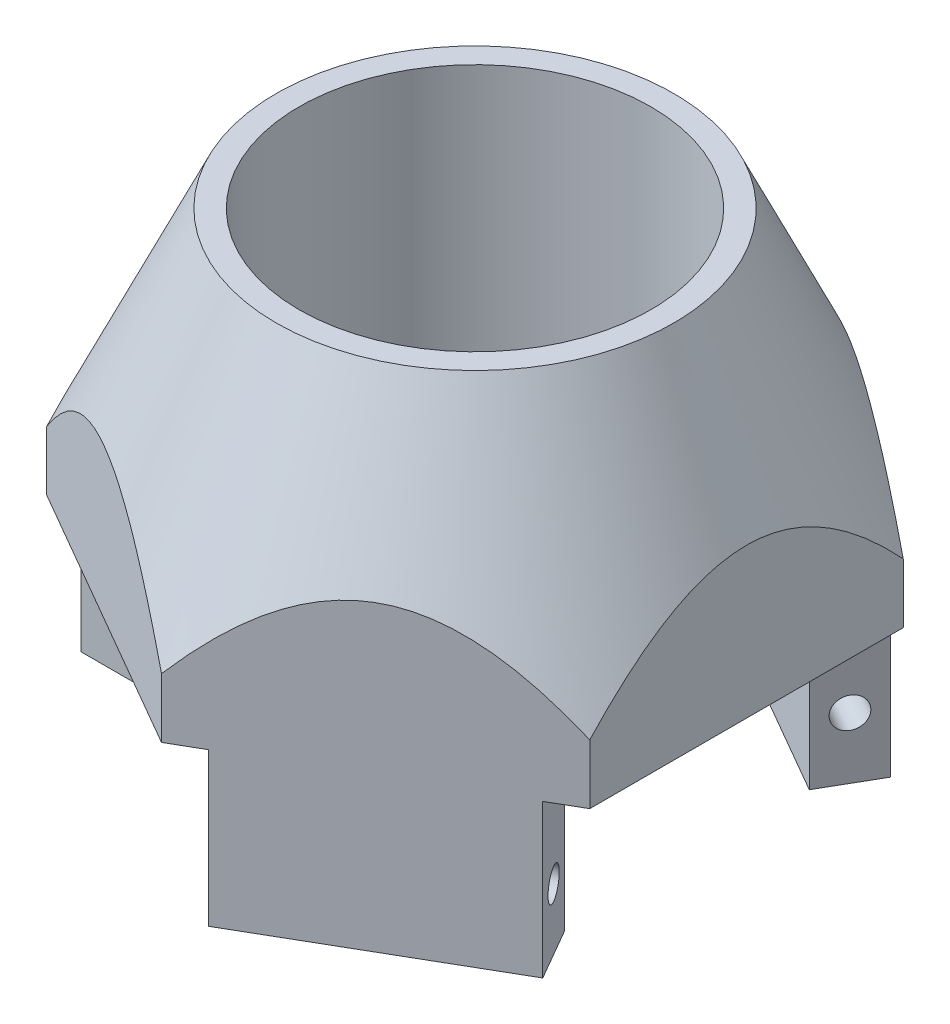
from build123d import *

# Parameters (mm, degrees)
SKETCH1_R           = 11.5
BOSS_EXTRUDE1_DEPTH = 30
SKETCH4_R           = 11.5
CUT_EXTRUDE1_DEPTH  = 10
SKETCH5_R           = 1
CUT_EXTRUDE2_DEPTH  = 46.027075188
SKETCH6_R           = 1
CUT_EXTRUDE3_DEPTH  = 46.928613086
SKETCH7_R           = 1
CUT_EXTRUDE4_DEPTH  = 46.928613086


with BuildPart() as part:
    # Sketch1 → Boss-Extrude1 (new body)
    with BuildSketch(Plane(origin=(0, 0, 0), x_dir=(1, 0, 0), z_dir=(0, 1, 0))):
        Polygon((0, 20.5), (-17.753520778, 10.25), (-17.753520778, -10.25), (0, -20.5), (17.753520778, -10.25), (17.753520778, 10.25), align=None)
        with Locations(Location((0, 0, 0), (0, 0, 270))):
            Circle(SKETCH1_R, mode=Mode.SUBTRACT)
    extrude(amount=BOSS_EXTRUDE1_DEPTH)

    # Sketch2 → Cut-Revolve1 (revolve, cut)
    with BuildSketch(Plane.XY, mode=Mode.PRIVATE) as cut_revolve1_sk:
        Polygon((20.5, 13.897411558), (13, 30), (0, 30), (0, 31.097791256), (25.351389146, 31.097791256), (24.973358823, 13.897411558), align=None)
    revolve(cut_revolve1_sk.sketch.rotate(Axis((0, 30, 0), (0, -1, 0)), 90), axis=Axis((0, 30, 0), (0, -1, 0)), mode=Mode.SUBTRACT)

    # Sketch4 → Cut-Extrude1 (cut)
    with BuildSketch(Plane.XZ):
        Polygon((-13.856406461, -8), (-17.753520778, -8), (-17.753520778, -10.25), (0, -20.5), (1.948557159, -19.375), (0, -16), (13.856406461, -8), (15.804963619, -11.375), (17.753520778, -10.25), (17.753520778, 10.25), (15.804963619, 11.375), (13.856406461, 8), (0, 16), (1.948557159, 19.375), (0, 20.5), (-17.753520778, 10.25), (-17.753520778, 8), (-13.856406461, 8), align=None)
        with Locations(Location((0, 0, 0), (0, 0, 270))):
            Circle(SKETCH4_R, mode=Mode.SUBTRACT)
    extrude(amount=-CUT_EXTRUDE1_DEPTH, mode=Mode.SUBTRACT)

    # Sketch5 → Cut-Extrude2 (cut, through all)
    with BuildSketch(Plane.XY.offset(8)):
        with Locations((-15.804963619, 4)):
            Circle(SKETCH5_R)
    extrude(amount=-CUT_EXTRUDE2_DEPTH, mode=Mode.SUBTRACT)

    # Sketch6 → Cut-Extrude3 (cut, through all)
    with BuildSketch(Plane(origin=(-6.92820323, 0, 4), x_dir=(0.5000000000000042, 0, 0.8660254037844363), z_dir=(-0.8660254037844362, 0, 0.5000000000000041))):
        with Locations((15.804963619, 4)):
            Circle(SKETCH6_R)
    extrude(amount=-CUT_EXTRUDE3_DEPTH, mode=Mode.SUBTRACT)

    # Sketch7 → Cut-Extrude4 (cut, through all)
    with BuildSketch(Plane(origin=(6.92820323, 0, 4), x_dir=(0.4999999999999912, 0, -0.8660254037844437), z_dir=(0.8660254037844437, 0, 0.4999999999999912))):
        with Locations((15.804963619, 4)):
            Circle(SKETCH7_R)
    extrude(amount=-CUT_EXTRUDE4_DEPTH, mode=Mode.SUBTRACT)


solid = part.part
